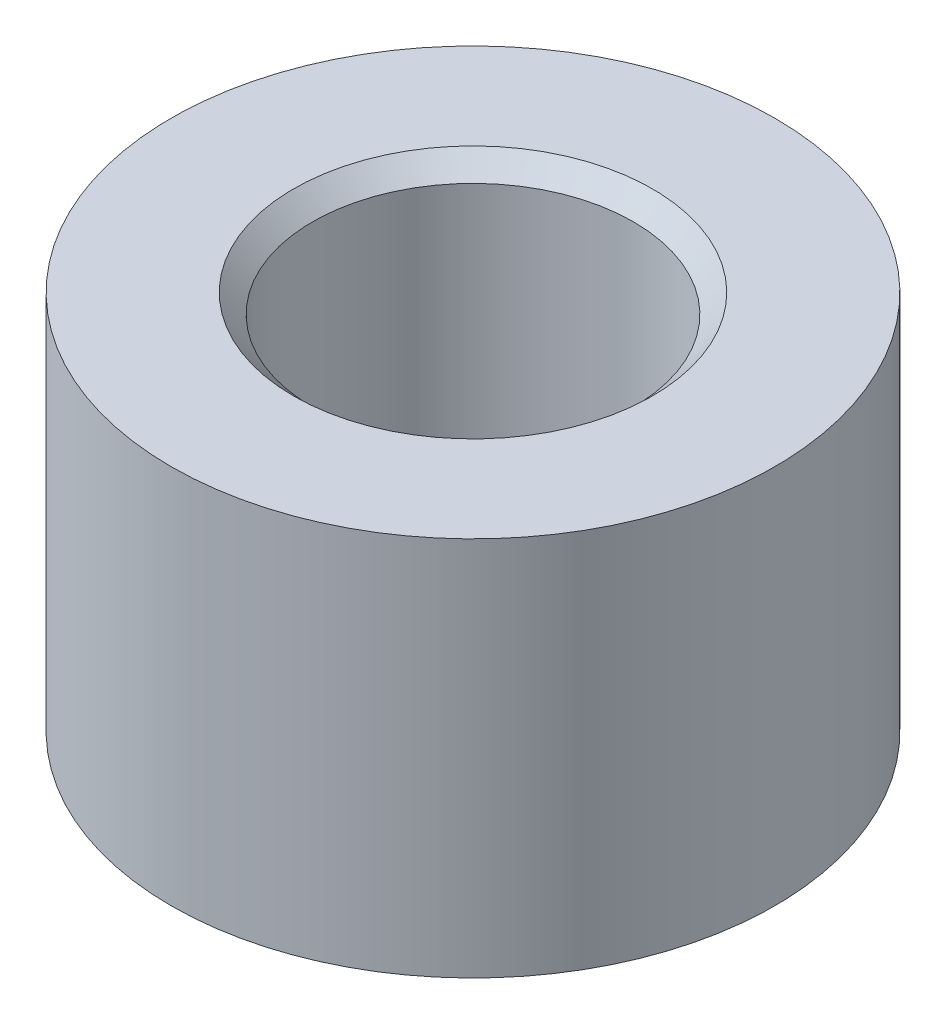
from build123d import *

# Parameters (mm, degrees)
SKETCH1_R           = 6.35
SKETCH1_R_2         = 3.375
BOSS_EXTRUDE1_DEPTH = 8.001
CHAMFER1_SIZE       = 0.4


with BuildPart() as part:
    # Sketch1 → Boss-Extrude1 (new body)
    with BuildSketch(Plane(origin=(0, 0, 0), x_dir=(1, 0, 0), z_dir=(0, 1, 0))):
        with Locations(Location((0, 0, 0), (0, 0, 270))):
            Circle(SKETCH1_R)
        with Locations(Location((0, 0, 0), (0, 0, 270))):
            Circle(SKETCH1_R_2, mode=Mode.SUBTRACT)
    extrude(amount=BOSS_EXTRUDE1_DEPTH)

    # Chamfer1
    chamfer1_edges = [part.edges().sort_by_distance(p)[0] for p in [
        (0, 0, -3.375),
        (0, 8.001, -3.375),
    ]]
    chamfer(chamfer1_edges, length=CHAMFER1_SIZE)


solid = part.part
